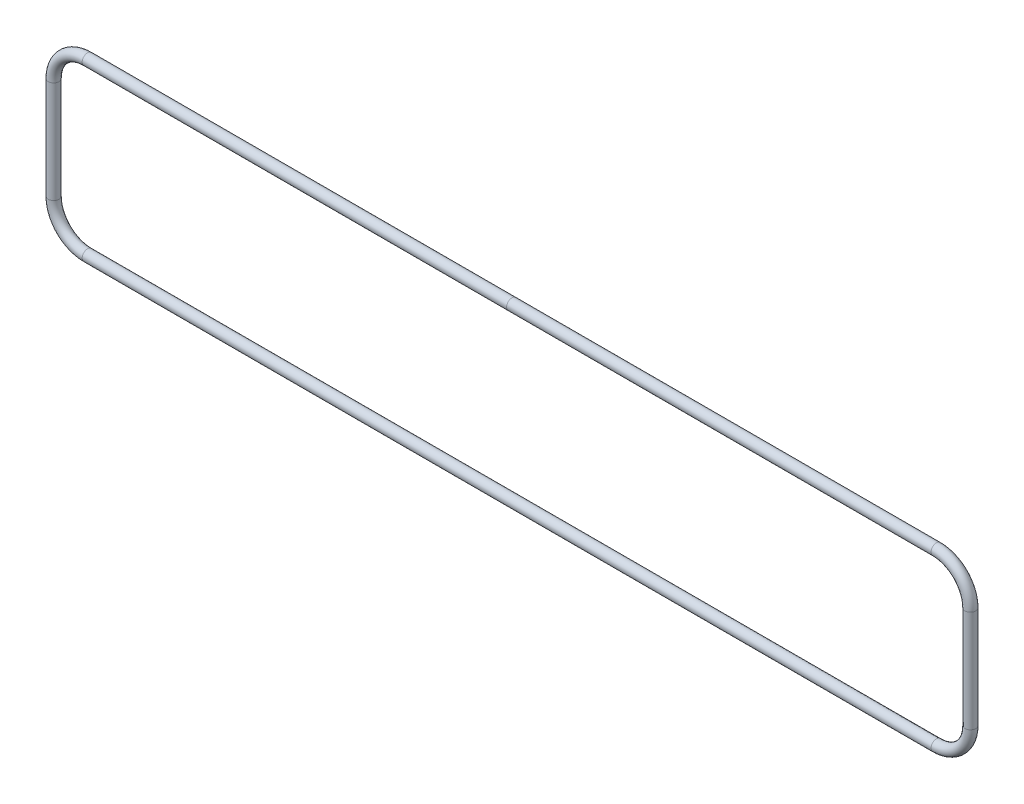
from build123d import *

# Parameters (mm, degrees)
ESBO_O2_R = 4.7625


with BuildPart() as part:
    # Varredura1: sweep along a path in Esboço1
    with BuildLine(Plane.XY) as varredura1_path:
        Line((375, -75), (-375, -75))
        ThreePointArc((-375, -75), (-396.213203436, -66.213203436), (-405, -45))
        Line((-405, -45), (-405, 45))
        ThreePointArc((-405, 45), (-396.213203436, 66.213203436), (-375, 75))
        Line((-375, 75), (375, 75))
        ThreePointArc((375, 75), (396.213203436, 66.213203436), (405, 45))
        Line((405, 45), (405, -45))
        ThreePointArc((405, -45), (396.213203436, -66.213203436), (375, -75))
    # Esboço2 → Varredura1 (sweep)
    with BuildSketch(Plane(origin=(0, 0, 0), x_dir=(0, 0, -1), z_dir=(1, 0, 0))):
        with Locations((0, 75)):
            Circle(ESBO_O2_R)
    sweep(path=varredura1_path.line)


solid = part.part
